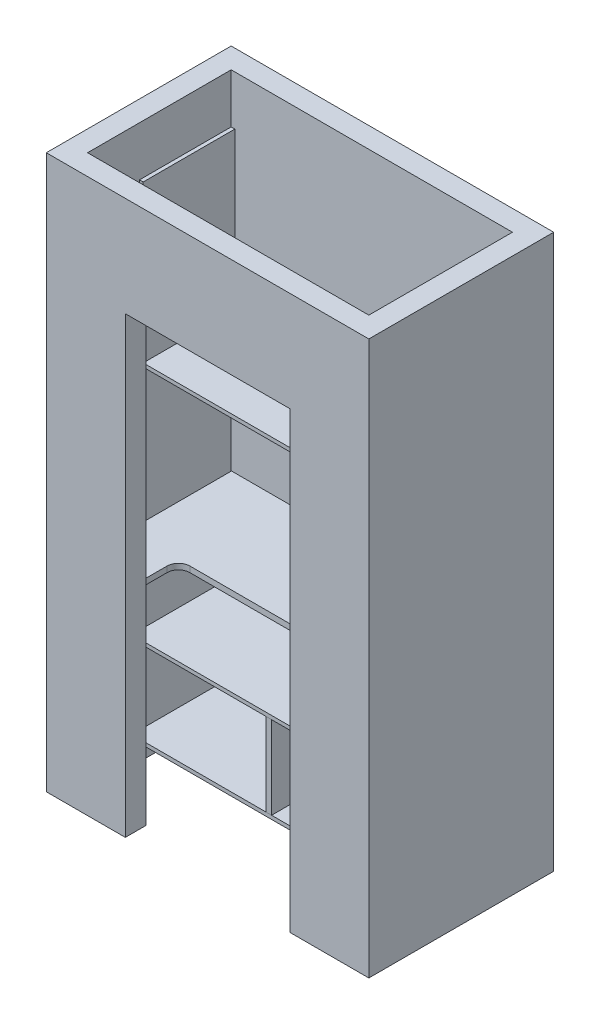
from build123d import *

# Parameters (mm, degrees)
SKETCH1_W             = 718
SKETCH1_H             = 90
BOSS_EXTRUDE1_DEPTH   = 2416
SKETCH2_W             = 718
SKETCH2_H             = 1980
CUT_EXTRUDE1_DEPTH    = 100
SKETCH6_W             = 16
SKETCH6_H             = 739
BOSS_EXTRUDE2_DEPTH   = 625
BOSS_EXTRUDE2_2_DEPTH = 625
SKETCH6_W_2           = 25
SKETCH6_H_2           = 361.5
BOSS_EXTRUDE2_3_DEPTH = 625
SKETCH7_W             = 1228
SKETCH7_H             = 16
BOSS_EXTRUDE3_DEPTH   = 450
BOSS_EXTRUDE3_2_DEPTH = 450
SKETCH7_H_2           = 25
BOSS_EXTRUDE3_3_DEPTH = 450
SKETCH8_W             = 16
SKETCH8_H             = 700
BOSS_EXTRUDE4_DEPTH   = 400
BOSS_EXTRUDE4_2_DEPTH = 400
SKETCH9_W             = 1196
SKETCH9_H             = 16
BOSS_EXTRUDE5_DEPTH   = 400
BOSS_EXTRUDE5_2_DEPTH = 400
SKETCH11_W            = 220
SKETCH11_H            = 177
BOSS_EXTRUDE6_DEPTH   = 25
FILLET1_R             = 50
SKETCH12_W            = 25
SKETCH12_H            = 361.5
CUT_EXTRUDE2_DEPTH    = 175
SKETCH18_W            = 1.5
SKETCH18_H            = 627
CUT_EXTRUDE5_DEPTH    = 2743.777606734


with BuildPart() as part:
    # Sketch1 → Boss-Extrude1 (new body)
    with BuildSketch(Plane(origin=(0, 0, 0), x_dir=(1, 0, 0), z_dir=(0, 1, 0))):
        Polygon((973, -627), (1228, -627), (1228, 0), (0, 0), (0, -627), (255, -627), (255, -717), (-90, -717), (-90, 90), (1318, 90), (1318, -717), (973, -717), align=None)
        with Locations((614, -672)):
            Rectangle(SKETCH1_W, SKETCH1_H)
    extrude(amount=BOSS_EXTRUDE1_DEPTH)

    # Sketch2 → Cut-Extrude1 (cut)
    with BuildSketch(Plane.XY.offset(717)):
        with Locations((614, 990)):
            Rectangle(SKETCH2_W, SKETCH2_H)
    extrude(amount=-CUT_EXTRUDE1_DEPTH, mode=Mode.SUBTRACT)


with BuildPart() as body_2:
    # Sketch6 → Boss-Extrude2 (new body)
    with BuildSketch(Plane.XY):
        with Locations((8, 505.5)):
            Rectangle(SKETCH6_W, SKETCH6_H)
    extrude(amount=BOSS_EXTRUDE2_DEPTH)


with BuildPart() as body_3:
    # Sketch6 → Boss-Extrude2 2 (new body)
    with BuildSketch(Plane.XY):
        with Locations((1220, 505.5)):
            Rectangle(SKETCH6_W, SKETCH6_H)
    extrude(amount=BOSS_EXTRUDE2_2_DEPTH)


with BuildPart() as body_4:
    # Sketch6 → Boss-Extrude2 3 (new body)
    with BuildSketch(Plane.XY):
        with Locations((614, 316.75)):
            Rectangle(SKETCH6_W_2, SKETCH6_H_2)
    extrude(amount=BOSS_EXTRUDE2_3_DEPTH)

    # Sketch12 → Cut-Extrude2 (cut)
    with BuildSketch(Plane.XY.offset(625)):
        with Locations((614, 316.75)):
            Rectangle(SKETCH12_W, SKETCH12_H)
    extrude(amount=-CUT_EXTRUDE2_DEPTH, mode=Mode.SUBTRACT)


with BuildPart() as body_5:
    # Sketch7 → Boss-Extrude3 (new body)
    with BuildSketch(Plane.XY):
        with Locations((614, 128)):
            Rectangle(SKETCH7_W, SKETCH7_H)
    extrude(amount=BOSS_EXTRUDE3_DEPTH)


with BuildPart() as body_6:
    # Sketch7 → Boss-Extrude3 2 (new body)
    with BuildSketch(Plane.XY):
        Polygon((16, 497.5), (626.5, 497.5), (1212, 497.5), (1212, 513.5), (601.5, 513.5), (16, 513.5), align=None)
    extrude(amount=BOSS_EXTRUDE3_2_DEPTH)


with BuildPart() as body_7:
    # Sketch7 → Boss-Extrude3 3 (new body)
    with BuildSketch(Plane.XY):
        with Locations((614, 887.5)):
            Rectangle(SKETCH7_W, SKETCH7_H_2)
    extrude(amount=BOSS_EXTRUDE3_3_DEPTH)

    # Sketch11 → Boss-Extrude6 (add)
    with BuildSketch(Plane(origin=(0, 900, 0), x_dir=(1, 0, 0), z_dir=(0, 1, 0))):
        with Locations((110, -538.5)):
            Rectangle(SKETCH11_W, SKETCH11_H)
        with Locations((1118, -538.5)):
            Rectangle(SKETCH11_W, SKETCH11_H)
    extrude(amount=-BOSS_EXTRUDE6_DEPTH)

    # Fillet1
    fillet1_edges = [body_7.edges().sort_by_distance(p)[0] for p in [
        (220, 887.5, 450),
        (1008, 887.5, 450),
    ]]
    fillet(fillet1_edges, radius=FILLET1_R)


with BuildPart() as body_8:
    # Sketch8 → Boss-Extrude4 (new body)
    with BuildSketch(Plane.XY):
        with Locations((8, 1850)):
            Rectangle(SKETCH8_W, SKETCH8_H)
    extrude(amount=BOSS_EXTRUDE4_DEPTH)


with BuildPart() as body_9:
    # Sketch8 → Boss-Extrude4 2 (new body)
    with BuildSketch(Plane.XY):
        with Locations((1220, 1850)):
            Rectangle(SKETCH8_W, SKETCH8_H)
    extrude(amount=BOSS_EXTRUDE4_2_DEPTH)


with BuildPart() as body_10:
    # Sketch9 → Boss-Extrude5 (new body)
    with BuildSketch(Plane.XY):
        with Locations((614, 1774)):
            Rectangle(SKETCH9_W, SKETCH9_H)
    extrude(amount=BOSS_EXTRUDE5_DEPTH)


with BuildPart() as body_11:
    # Sketch9 → Boss-Extrude5 2 (new body)
    with BuildSketch(Plane.XY):
        with Locations((614, 1508)):
            Rectangle(SKETCH9_W, SKETCH9_H)
    extrude(amount=BOSS_EXTRUDE5_2_DEPTH)


with BuildPart() as cut_extrude5_tool:
    # Sketch18 → Cut-Extrude5 (new, through all)
    with BuildSketch(Plane.XZ.offset(-120)):
        with Locations((0.75, 313.5)):
            Rectangle(SKETCH18_W, SKETCH18_H)
        with Locations((1227.25, 313.5)):
            Rectangle(SKETCH18_W, SKETCH18_H)
    extrude(amount=-CUT_EXTRUDE5_DEPTH)


with BuildPart() as body_5_1:
    add(body_5.part)

    # Cut-Extrude5: cut by cut_extrude5_tool
    add(cut_extrude5_tool.part, mode=Mode.SUBTRACT)


with BuildPart() as body_7_1:
    add(body_7.part)

    # Cut-Extrude5: cut by cut_extrude5_tool
    add(cut_extrude5_tool.part, mode=Mode.SUBTRACT)


solid = Compound([part.part, body_2.part, body_3.part, body_4.part, body_6.part, body_8.part, body_9.part, body_10.part, body_11.part, body_5_1.part, body_7_1.part])
